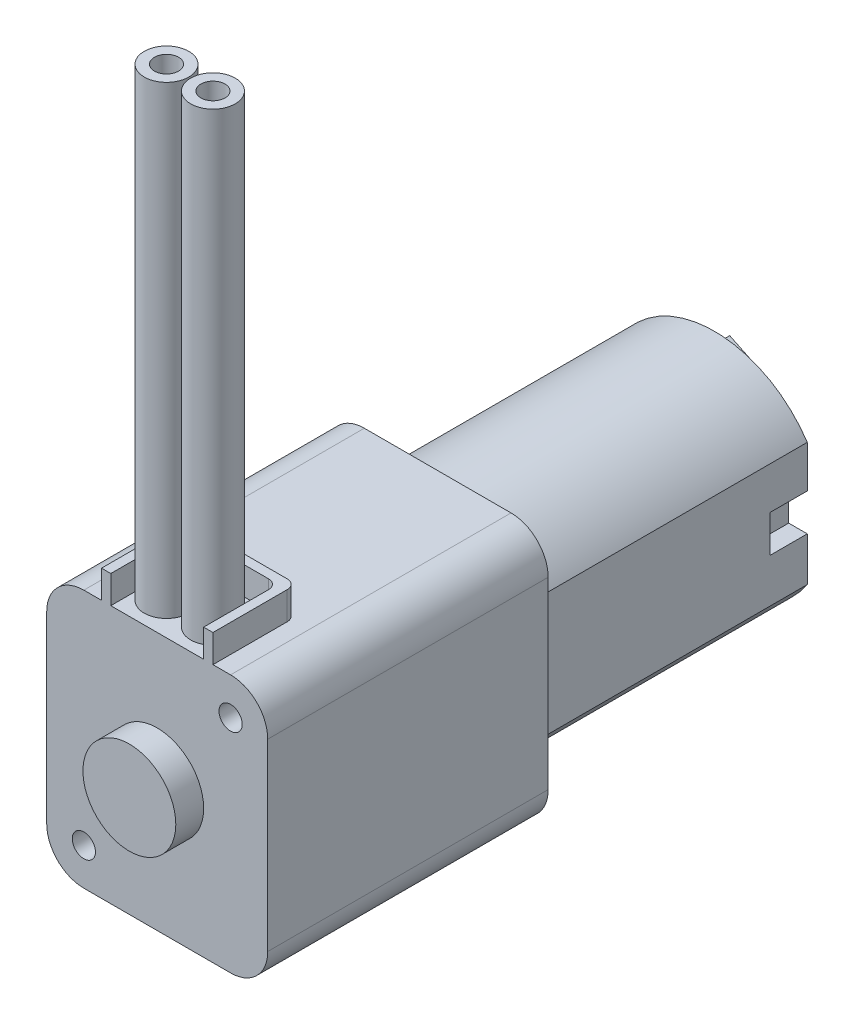
from build123d import *

# Parameters (mm, degrees)
EXTRUDE_1_DEPTH   = 15.1
SKETCH_2_R        = 2.5
EXTRUDE_2_DEPTH   = 1.5
EXTRUDE_3_DEPTH   = 1.5
M1_6X0_35_1_D     = 1.25
M1_6X0_35_1_DEPTH = 4.95
M1_6X0_35_1_TIP   = 0.375537887
EXTRUDE_4_DEPTH   = 14.9
SKETCH_7_3_W      = 1
SKETCH_7_3_H      = 2
EXTRUDE_5_DEPTH   = 12.9
SKETCH_8_R        = 2
EXTRUDE_6_DEPTH   = 1.1
EXTRUDE_7_DEPTH   = 1.5
SKETCH_10_R       = 1.2
SKETCH_10_R_2     = 0.65
EXTRUDE_13_DEPTH  = 25


with BuildPart() as part:
    # ｽｹｯﾁ1 → ﾎﾞｽ - 押し出し1 (new body)
    with BuildSketch(Plane.XY):
        with BuildLine():
            Line((-40.194845485, 23.273623853), (-32.294845485, 23.273623853))
            ThreePointArc((-32.294845485, 23.273623853), (-30.880631923, 22.687837416), (-30.294845485, 21.273623853))
            Line((-30.294845485, 21.273623853), (-30.294845485, 11.373623853))
            ThreePointArc((-30.294845485, 11.373623853), (-30.880631923, 9.959410291), (-32.294845485, 9.373623853))
            Line((-32.294845485, 9.373623853), (-40.194845485, 9.373623853))
            ThreePointArc((-40.194845485, 9.373623853), (-41.609059048, 9.959410291), (-42.194845485, 11.373623853))
            Line((-42.194845485, 11.373623853), (-42.194845485, 21.273623853))
            ThreePointArc((-42.194845485, 21.273623853), (-41.609059048, 22.687837416), (-40.194845485, 23.273623853))
        make_face()
    extrude(amount=EXTRUDE_1_DEPTH)

    # ｽｹｯﾁ2 → ﾎﾞｽ - 押し出し2 (add)
    with BuildSketch(Plane.XY.offset(15.1)):
        with Locations((-36.244845485, 16.323623853)):
            Circle(SKETCH_2_R)
    extrude(amount=EXTRUDE_2_DEPTH)

    # ｽｹｯﾁ3 → ﾎﾞｽ - 押し出し3 (add)
    with BuildSketch(Plane(origin=(0, 23.273623853, 0), x_dir=(1, 0, 0), z_dir=(0, 1, 0))):
        with BuildLine():
            Line((-33.744845485, -10.6), (-38.744845485, -10.6))
            ThreePointArc((-38.744845485, -10.6), (-39.098398876, -10.746446609), (-39.244845485, -11.1))
            Line((-39.244845485, -11.1), (-39.244845485, -15.1))
            Line((-39.244845485, -15.1), (-38.744845485, -15.1))
            Line((-38.744845485, -15.1), (-38.744845485, -14.6))
            Line((-38.744845485, -14.6), (-38.744845485, -11.6))
            ThreePointArc((-38.744845485, -11.6), (-38.598398876, -11.246446609), (-38.244845485, -11.1))
            Line((-38.244845485, -11.1), (-34.244845485, -11.1))
            ThreePointArc((-34.244845485, -11.1), (-33.891292095, -11.246446609), (-33.744845485, -11.6))
            Line((-33.744845485, -11.6), (-33.744845485, -14.6))
            Line((-33.744845485, -14.6), (-33.744845485, -15.1))
            Line((-33.744845485, -15.1), (-33.244845485, -15.1))
            Line((-33.244845485, -15.1), (-33.244845485, -11.1))
            ThreePointArc((-33.244845485, -11.1), (-33.391292095, -10.746446609), (-33.744845485, -10.6))
        make_face()
    extrude(amount=EXTRUDE_3_DEPTH)

    # M1.6x0.35 ねじ穴1
    with Locations(Plane(origin=(-32.294845485, 21.273623853, 15.1), x_dir=(1, 0, 0), z_dir=(0, 0, 1))):
        with Locations((0, 0), (-7.9, -9.9)):
            Hole(M1_6X0_35_1_D / 2, depth=M1_6X0_35_1_DEPTH)
            with Locations((0, 0, -(M1_6X0_35_1_DEPTH + M1_6X0_35_1_TIP / 2))):  # 118° drill point
                Cone(0, M1_6X0_35_1_D / 2, M1_6X0_35_1_TIP, mode=Mode.SUBTRACT)

    # ｽｹｯﾁ7 → ﾎﾞｽ - 押し出し4 (add)
    with BuildSketch(Plane(origin=(0, 0, 0), x_dir=(-1, 0, 0), z_dir=(0, 0, -1))):
        with BuildLine():
            ThreePointArc((41.244845485, 19.640248644), (36.244845485, 22.323623853), (31.244845485, 19.640248644))
            Line((31.244845485, 19.640248644), (31.244845485, 17.373623853))
            Line((31.244845485, 17.373623853), (32.244845485, 17.373623853))
            Line((32.244845485, 17.373623853), (32.244845485, 15.373623853))
            Line((32.244845485, 15.373623853), (31.244845485, 15.373623853))
            Line((31.244845485, 15.373623853), (31.244845485, 13.006999063))
            ThreePointArc((31.244845485, 13.006999063), (33.072229159, 11.231030639), (35.471864244, 10.373623853))
            Line((35.471864244, 10.373623853), (37.017826727, 10.373623853))
            ThreePointArc((37.017826727, 10.373623853), (39.417461811, 11.231030639), (41.244845485, 13.006999063))
            Line((41.244845485, 13.006999063), (41.244845485, 15.373623853))
            Line((41.244845485, 15.373623853), (40.244845485, 15.373623853))
            Line((40.244845485, 15.373623853), (40.244845485, 17.373623853))
            Line((40.244845485, 17.373623853), (41.244845485, 17.373623853))
            Line((41.244845485, 17.373623853), (41.244845485, 19.640248644))
        make_face()
    extrude(amount=EXTRUDE_4_DEPTH)

    # ｽｹｯﾁ7<3> → ﾎﾞｽ - 押し出し5 (add)
    with BuildSketch(Plane(origin=(0, 0, 0), x_dir=(-1, 0, 0), z_dir=(0, 0, -1))):
        with Locations((31.744845485, 16.373623853)):
            Rectangle(SKETCH_7_3_W, SKETCH_7_3_H)
        with Locations((40.744845485, 16.373623853)):
            Rectangle(SKETCH_7_3_W, SKETCH_7_3_H)
    extrude(amount=EXTRUDE_5_DEPTH)

    # ｽｹｯﾁ8 → ﾎﾞｽ - 押し出し6 (add)
    with BuildSketch(Plane(origin=(0, 0, -14.9), x_dir=(-1, 0, 0), z_dir=(0, 0, -1))):
        with Locations((36.244845485, 16.323623853)):
            Circle(SKETCH_8_R)
    extrude(amount=EXTRUDE_6_DEPTH)

    # ｽｹｯﾁ8<3> → ﾎﾞｽ - 押し出し7 (add)
    with BuildSketch(Plane(origin=(0, 0, -14.9), x_dir=(-1, 0, 0), z_dir=(0, 0, -1))):
        Polygon((36.920421996, 21.028017883), (35.569268974, 20.376569105), (35.654303745, 20.200200691), (37.005456768, 20.851649469), align=None)
        Polygon((35.569268974, 11.619229823), (36.920421996, 12.270678601), (36.835387225, 12.447047016), (35.484234203, 11.795598237), align=None)
    extrude(amount=EXTRUDE_7_DEPTH)

    # ｽｹｯﾁ10 → ﾎﾞｽ - 押し出し13 (add)
    # profile 1 of 2: a face of its own
    with BuildSketch(Plane(origin=(0, 23.273623853, 0), x_dir=(1, 0, 0), z_dir=(0, 1, 0))):
        with Locations((-37.494845485, -13.35)):
            Circle(SKETCH_10_R)
        with Locations((-37.494845485, -13.35)):
            Circle(SKETCH_10_R_2, mode=Mode.SUBTRACT)
    # profile 2 of 2: a face of its own
    with BuildSketch(Plane(origin=(0, 23.273623853, 0), x_dir=(1, 0, 0), z_dir=(0, 1, 0))):
        with Locations((-34.994845485, -13.35)):
            Circle(SKETCH_10_R)
        with Locations((-34.994845485, -13.35)):
            Circle(SKETCH_10_R_2, mode=Mode.SUBTRACT)
    extrude(amount=EXTRUDE_13_DEPTH)


solid = part.part
